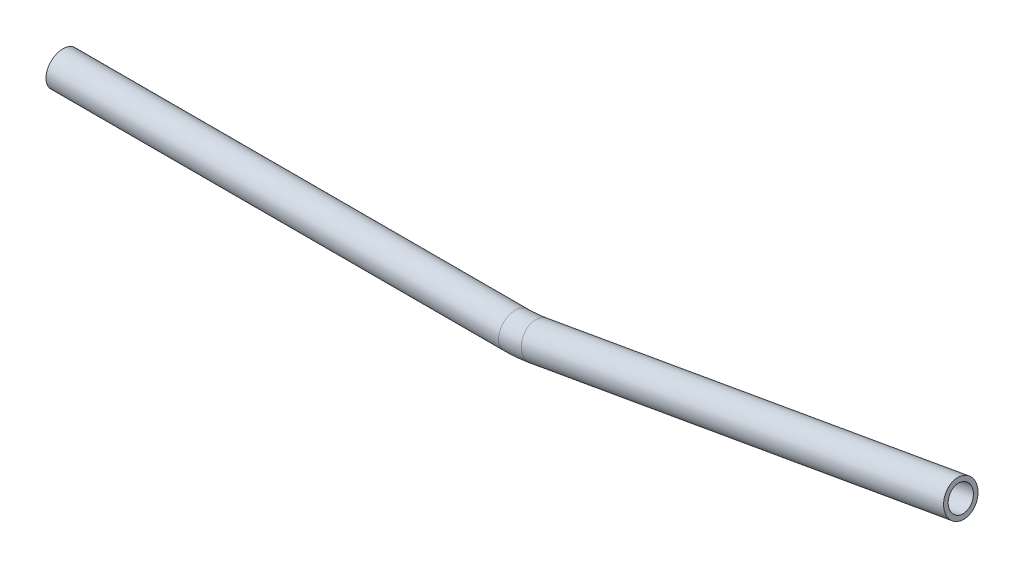
from build123d import *

# Parameters (mm, degrees)
SKETCH6_R   = 7.5
SKETCH6_R_2 = 5.5


with BuildPart() as part:
    # Sweep1: sweep along a path in Sketch5
    with BuildLine(Plane.XY) as sweep1_path:
        Line((-190.178402047, -2.510858626), (9.821597953, -2.510858626))
        ThreePointArc((9.821597953, -2.510858626), (15.090323537, -2.280821099), (20.318950938, -1.592459243))
        Line((20.318950938, -1.592459243), (206.889954864, 31.305042567))
    # Sketch6 → Sweep1 (sweep)
    with BuildSketch(Plane(origin=(-190.178402047, 0, 0), x_dir=(0, 0, -1), z_dir=(1, 0, 0))):
        with Locations((0, -1.011000549)):
            Circle(SKETCH6_R)
        with Locations((0, -1.011000549)):
            Circle(SKETCH6_R_2, mode=Mode.SUBTRACT)
    sweep(path=sweep1_path.line)


solid = part.part
